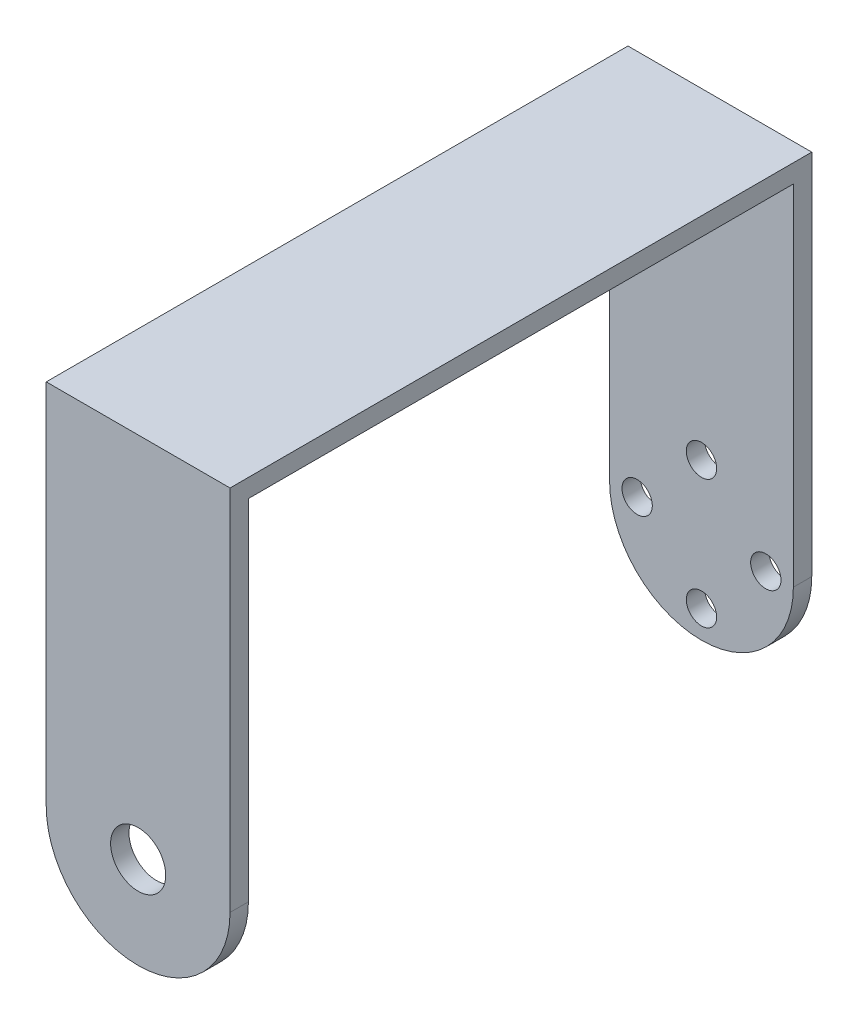
from build123d import *

# Parameters (mm, degrees)
EXTRUDE_1_DEPTH     = 2
SKETCH_2_W          = 20
SKETCH_2_H          = 2
EXTRUDE_2_DEPTH     = 61.3
CUT_EXTRUDE_1_REACH = 79.504
SKETCH_4_R          = 3
CUT_EXTRUDE_2_REACH = 79.504
SKETCH_5_R          = 1.65


with BuildPart() as part:
    # 草图1 → 凸台-拉伸1 (new body)
    with BuildSketch(Plane.XY):
        with BuildLine():
            Line((0, 0), (0, 40))
            Line((0, 40), (20, 40))
            Line((20, 40), (20, 0))
            ThreePointArc((20, 0), (10, -10), (0, 0))
        make_face()
    extrude_1 = extrude(amount=EXTRUDE_1_DEPTH)

    # 草图2 → 凸台-拉伸2 (add)
    with BuildSketch(Plane.XY.offset(2)):
        with Locations((10, 39)):
            Rectangle(SKETCH_2_W, SKETCH_2_H)
    extrude(amount=EXTRUDE_2_DEPTH)

    # 镜向1: 凸台-拉伸1 across plane
    add(extrude_1.mirror(Plane.XY.offset(31.65)))

    # 草图4 → 切除-拉伸1 (cut, up to next)
    with BuildSketch(Plane.XY.offset(63.3), mode=Mode.PRIVATE) as cut_extrude_1_sk1:
        with Locations((10, 0)):
            Circle(SKETCH_4_R)
    cut_extrude_1_tool1 = extrude(cut_extrude_1_sk1.sketch, amount=-CUT_EXTRUDE_1_REACH, mode=Mode.PRIVATE) & part.part
    add(cut_extrude_1_tool1.solids().sort_by_distance((10, 0, 63.3))[0], mode=Mode.SUBTRACT)

    # 草图5 → 切除-拉伸2 (cut, up to next)
    with BuildSketch(Plane(origin=(0, 0, 0), x_dir=(-1, 0, 0), z_dir=(0, 0, -1)), mode=Mode.PRIVATE) as cut_extrude_2_sk1:
        with Locations((-10, -7)):
            Circle(SKETCH_5_R)
    cut_extrude_2_tool1 = extrude(cut_extrude_2_sk1.sketch, amount=-CUT_EXTRUDE_2_REACH, mode=Mode.PRIVATE) & part.part
    # 草图5 → 切除-拉伸2 (cut, up to next)
    with BuildSketch(Plane(origin=(0, 0, 0), x_dir=(-1, 0, 0), z_dir=(0, 0, -1)), mode=Mode.PRIVATE) as cut_extrude_2_sk2:
        with Locations((-17, 0)):
            Circle(SKETCH_5_R)
    cut_extrude_2_tool2 = extrude(cut_extrude_2_sk2.sketch, amount=-CUT_EXTRUDE_2_REACH, mode=Mode.PRIVATE) & part.part
    # 草图5 → 切除-拉伸2 (cut, up to next)
    with BuildSketch(Plane(origin=(0, 0, 0), x_dir=(-1, 0, 0), z_dir=(0, 0, -1)), mode=Mode.PRIVATE) as cut_extrude_2_sk3:
        with Locations((-10, 7)):
            Circle(SKETCH_5_R)
    cut_extrude_2_tool3 = extrude(cut_extrude_2_sk3.sketch, amount=-CUT_EXTRUDE_2_REACH, mode=Mode.PRIVATE) & part.part
    # 草图5 → 切除-拉伸2 (cut, up to next)
    with BuildSketch(Plane(origin=(0, 0, 0), x_dir=(-1, 0, 0), z_dir=(0, 0, -1)), mode=Mode.PRIVATE) as cut_extrude_2_sk4:
        with Locations((-3, 0)):
            Circle(SKETCH_5_R)
    cut_extrude_2_tool4 = extrude(cut_extrude_2_sk4.sketch, amount=-CUT_EXTRUDE_2_REACH, mode=Mode.PRIVATE) & part.part
    add(cut_extrude_2_tool1.solids().sort_by_distance((10, -7, 0))[0], mode=Mode.SUBTRACT)
    add(cut_extrude_2_tool2.solids().sort_by_distance((17, 0, 0))[0], mode=Mode.SUBTRACT)
    add(cut_extrude_2_tool3.solids().sort_by_distance((10, 7, 0))[0], mode=Mode.SUBTRACT)
    add(cut_extrude_2_tool4.solids().sort_by_distance((3, 0, 0))[0], mode=Mode.SUBTRACT)


solid = part.part
